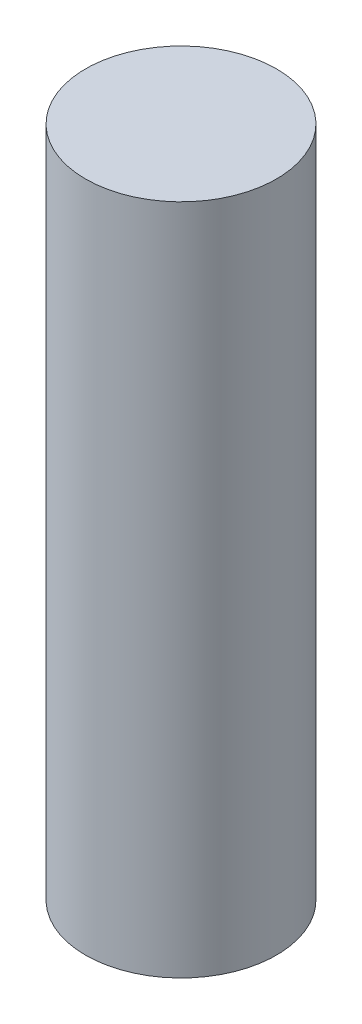
from build123d import *

# Parameters (mm, degrees)
ESQUISSE1_R        = 7.1
BOSS_EXTRU_1_DEPTH = 50


with BuildPart() as part:
    # Esquisse1 → Boss.-Extru.1 (new body)
    with BuildSketch(Plane(origin=(0, 0, 0), x_dir=(1, 0, 0), z_dir=(0, 1, 0))):
        with Locations(Location((0, 0, 0), (0, 0, 270))):
            Circle(ESQUISSE1_R)
    extrude(amount=BOSS_EXTRU_1_DEPTH)


solid = part.part
